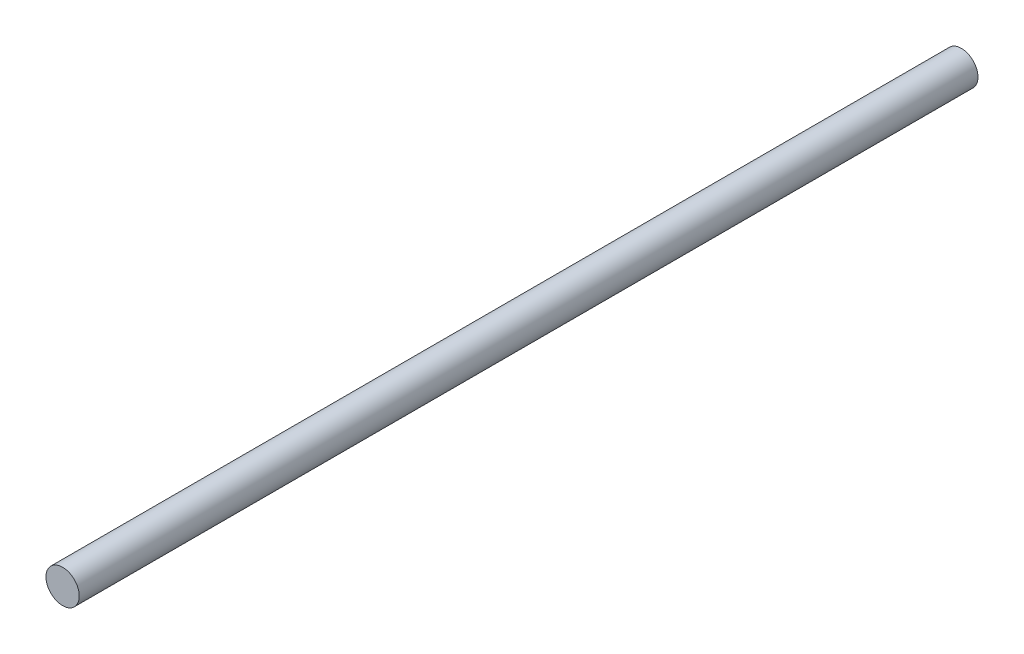
from build123d import *

# Parameters (mm, degrees)
SKETCH_1_R      = 3
EXTRUDE_1_DEPTH = 162


with BuildPart() as part:
    # 草图1 → 凸台-拉伸1 (new body)
    with BuildSketch(Plane.XY):
        Circle(SKETCH_1_R)
    extrude(amount=EXTRUDE_1_DEPTH)


solid = part.part
